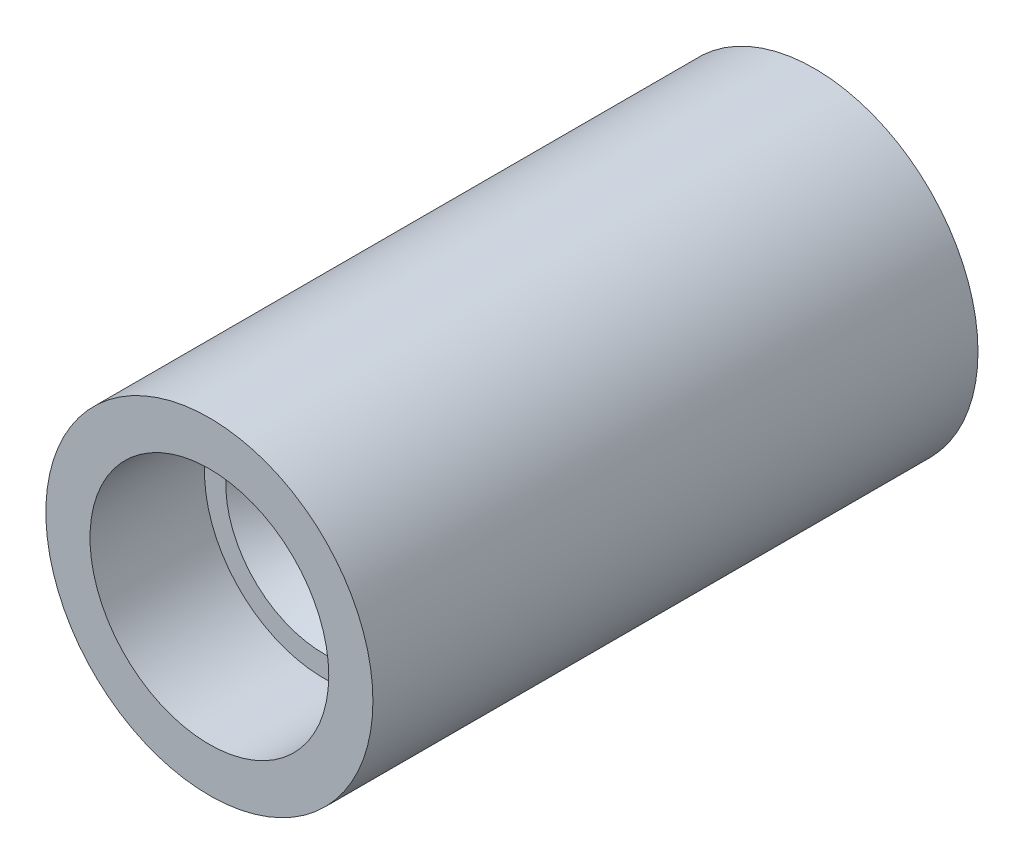
from build123d import *

# Parameters (mm, degrees)
SKETCH1_R           = 5
BOSS_EXTRUDE1_DEPTH = 18.5
SKETCH2_R           = 2
CUT_EXTRUDE1_DEPTH  = 18.5
SKETCH3_R           = 3.65
CUT_EXTRUDE2_DEPTH  = 3.5
CUT_EXTRUDE3_START  = -10.5
SKETCH4_R           = 3.65
CUT_EXTRUDE3_DEPTH  = 10.5
CHAMFER1_SIZE       = 1.5
CHAMFER2_SIZE       = 1
CUT_EXTRUDE4_DEPTH  = 5


with BuildPart() as part:
    # Sketch1 → Boss-Extrude1 (new body)
    with BuildSketch(Plane.XY):
        Circle(SKETCH1_R)
    extrude(amount=BOSS_EXTRUDE1_DEPTH)

    # Sketch2 → Cut-Extrude1 (cut)
    with BuildSketch(Plane.XY.offset(18.5)):
        Circle(SKETCH2_R)
    extrude(amount=-CUT_EXTRUDE1_DEPTH, mode=Mode.SUBTRACT)

    # Sketch3 → Cut-Extrude2 (cut)
    with BuildSketch(Plane.XY.offset(18.5)):
        Circle(SKETCH3_R)
    extrude(amount=-CUT_EXTRUDE2_DEPTH, mode=Mode.SUBTRACT)

    # Sketch4 → Cut-Extrude3 (cut)
    with BuildSketch(Plane(origin=(0, 0, 0), x_dir=(-1, 0, 0), z_dir=(0, 0, -1)).offset(CUT_EXTRUDE3_START)):
        with Locations(Location((0, 0, 0), (0, 0, 180))):
            Circle(SKETCH4_R)
    extrude(amount=CUT_EXTRUDE3_DEPTH, mode=Mode.SUBTRACT)

    # Chamfer1
    chamfer1_edges = [part.edges().sort_by_distance(p)[0] for p in [
        (-2, 0, 10.5),
    ]]
    chamfer(chamfer1_edges, length=CHAMFER1_SIZE)

    # Chamfer2
    chamfer2_edges = [part.edges().sort_by_distance(p)[0] for p in [
        (-2, 0, 15),
    ]]
    chamfer(chamfer2_edges, length=CHAMFER2_SIZE)

    # Sketch5 → Cut-Extrude4 (cut)
    with BuildSketch(Plane(origin=(0, 0, 0), x_dir=(-1, 0, 0), z_dir=(0, 0, -1))):
        Polygon((0, 4.214656965), (-3.65, 2.107328483), (-3.65, -2.107328483), (0, -4.214656965), (3.65, -2.107328483), (3.65, 2.107328483), align=None)
    extrude(amount=-CUT_EXTRUDE4_DEPTH, mode=Mode.SUBTRACT)


solid = part.part
